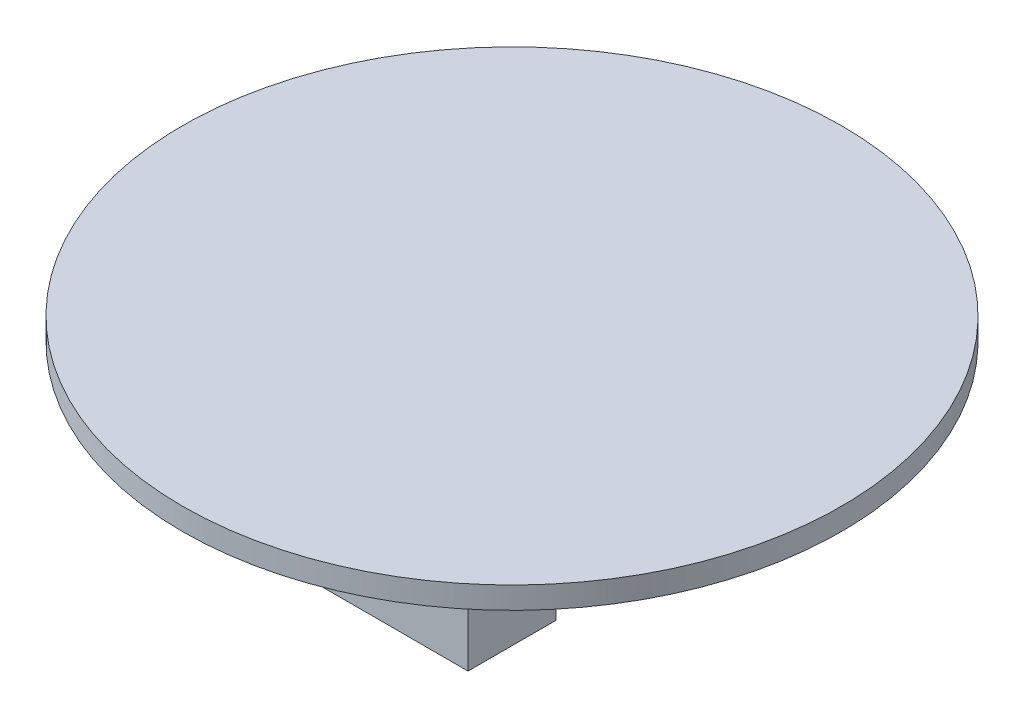
from build123d import *

# Parameters (mm, degrees)
SKETCH1_R           = 75
BOSS_EXTRUDE1_DEPTH = 5
SKETCH2_W           = 50
SKETCH2_H           = 20
BOSS_EXTRUDE2_DEPTH = 20
CUT_EXTRUDE1_START  = -2.5
CUT_EXTRUDE1_DEPTH  = 18
CUT_EXTRUDE2_DEPTH  = 27
CUT_EXTRUDE3_REACH  = 115.275
CUT_EXTRUDE4_REACH  = 117.109
SKETCH6_R           = 1


with BuildPart() as part:
    # Sketch1 → Boss-Extrude1 (new body)
    with BuildSketch(Plane(origin=(0, 0, 0), x_dir=(1, 0, 0), z_dir=(0, 1, 0))):
        with Locations(Location((0, 0, 0), (0, 0, 270))):
            Circle(SKETCH1_R)
    extrude(amount=BOSS_EXTRUDE1_DEPTH)

    # Sketch2 → Boss-Extrude2 (add)
    with BuildSketch(Plane(origin=(0, 0, 0), x_dir=(-1, 0, 0), z_dir=(0, -1, 0))):
        with Locations((-15, -40)):
            Rectangle(SKETCH2_W, SKETCH2_H)
    extrude(amount=BOSS_EXTRUDE2_DEPTH)

    # Sketch3 → Cut-Extrude1 (cut)
    with BuildSketch(Plane.ZY.offset(10).offset(CUT_EXTRUDE1_START)):
        with BuildLine():
            Line((32, -15), (32, -20))
            Line((32, -20), (48, -20))
            Line((48, -20), (48, -15))
            ThreePointArc((48, -15), (40, -7), (32, -15))
        make_face()
    extrude(amount=-CUT_EXTRUDE1_DEPTH, mode=Mode.SUBTRACT)

    # Sketch4 → Cut-Extrude2 (cut)
    with BuildSketch(Plane.ZY.offset(-10.5)):
        with BuildLine():
            Line((31, -15), (31, -20))
            Line((31, -20), (49, -20))
            Line((49, -20), (49, -15))
            ThreePointArc((49, -15), (40, -6), (31, -15))
        make_face()
    extrude(amount=-CUT_EXTRUDE2_DEPTH, mode=Mode.SUBTRACT)

    # Sketch5 → Cut-Extrude3 (cut, up to next)
    with BuildSketch(Plane(origin=(-7.5, 0, 0), x_dir=(0, 0, -1), z_dir=(1, 0, 0)), mode=Mode.PRIVATE) as cut_extrude3_sk1:
        with BuildLine():
            Line((-36.25, -15), (-36.25, -20))
            Line((-36.25, -20), (-43.75, -20))
            Line((-43.75, -20), (-43.75, -15))
            ThreePointArc((-43.75, -15), (-40, -11.25), (-36.25, -15))
        make_face()
    cut_extrude3_tool1 = extrude(cut_extrude3_sk1.sketch, amount=-CUT_EXTRUDE3_REACH, mode=Mode.PRIVATE) & part.part
    add(cut_extrude3_tool1.solids().sort_by_distance((-7.5, -15.983293, 40))[0], mode=Mode.SUBTRACT)

    # Sketch6 → Cut-Extrude4 (cut, up to next)
    with BuildSketch(Plane.ZY.offset(10), mode=Mode.PRIVATE) as cut_extrude4_sk1:
        with Locations((45.5, -15)):
            Circle(SKETCH6_R)
    cut_extrude4_tool1 = extrude(cut_extrude4_sk1.sketch, amount=-CUT_EXTRUDE4_REACH, mode=Mode.PRIVATE) & part.part
    # Sketch6 → Cut-Extrude4 (cut, up to next)
    with BuildSketch(Plane.ZY.offset(10), mode=Mode.PRIVATE) as cut_extrude4_sk2:
        with Locations((34.5, -15)):
            Circle(SKETCH6_R)
    cut_extrude4_tool2 = extrude(cut_extrude4_sk2.sketch, amount=-CUT_EXTRUDE4_REACH, mode=Mode.PRIVATE) & part.part
    add(cut_extrude4_tool1.solids().sort_by_distance((-10, -15, 45.5))[0], mode=Mode.SUBTRACT)
    add(cut_extrude4_tool2.solids().sort_by_distance((-10, -15, 34.5))[0], mode=Mode.SUBTRACT)


solid = part.part
